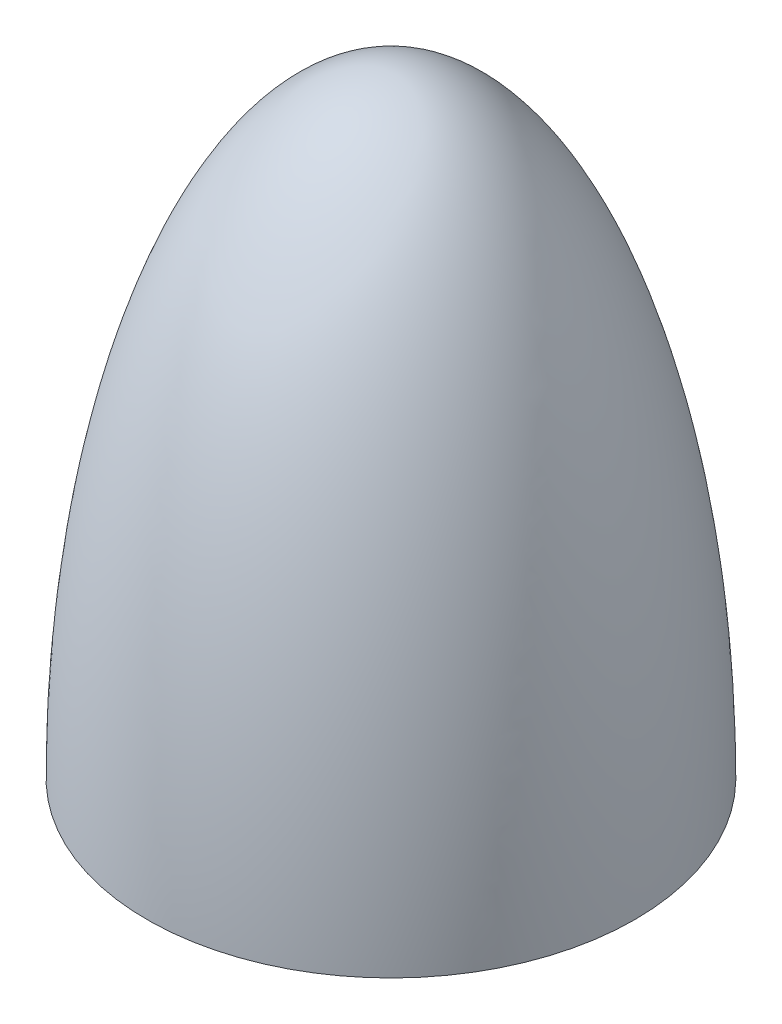
from build123d import *


with BuildPart() as part:
    # Sketch3 → Revolve3 (revolve)
    with BuildSketch(Plane.XY):
        with BuildLine():
            add(Edge.make_bspline(
                [(55.2, 0), (55.2, 140), (0, 140)],
                knots=[4.71238898, 4.71238898, 4.71238898, 6.283185307, 6.283185307, 6.283185307], degree=2, weights=[1, 0.707106781, 1]))
            Line((55.2, 0), (56.4, 0))
            add(Edge.make_bspline(
                [(56.4, 0), (56.4, 18.386255759), (53.517201339, 55.158767277), (43.239994486, 94.176071093), (31.910527156, 117.756658921), (22.156018555, 130.995707626), (11.42522322, 139.283492156), (3.80840774, 141.2), (0, 141.2)],
                knots=[4.71238898, 4.71238898, 4.71238898, 4.71238898, 5.105088062, 5.497787144, 5.694136685, 5.890486225, 6.086835766, 6.283185307, 6.283185307, 6.283185307, 6.283185307], degree=3))
            Line((0, 141.2), (0, 140))
        make_face()
    revolve(axis=Axis((0, 0, 0), (0, 1, 0)))


solid = part.part
